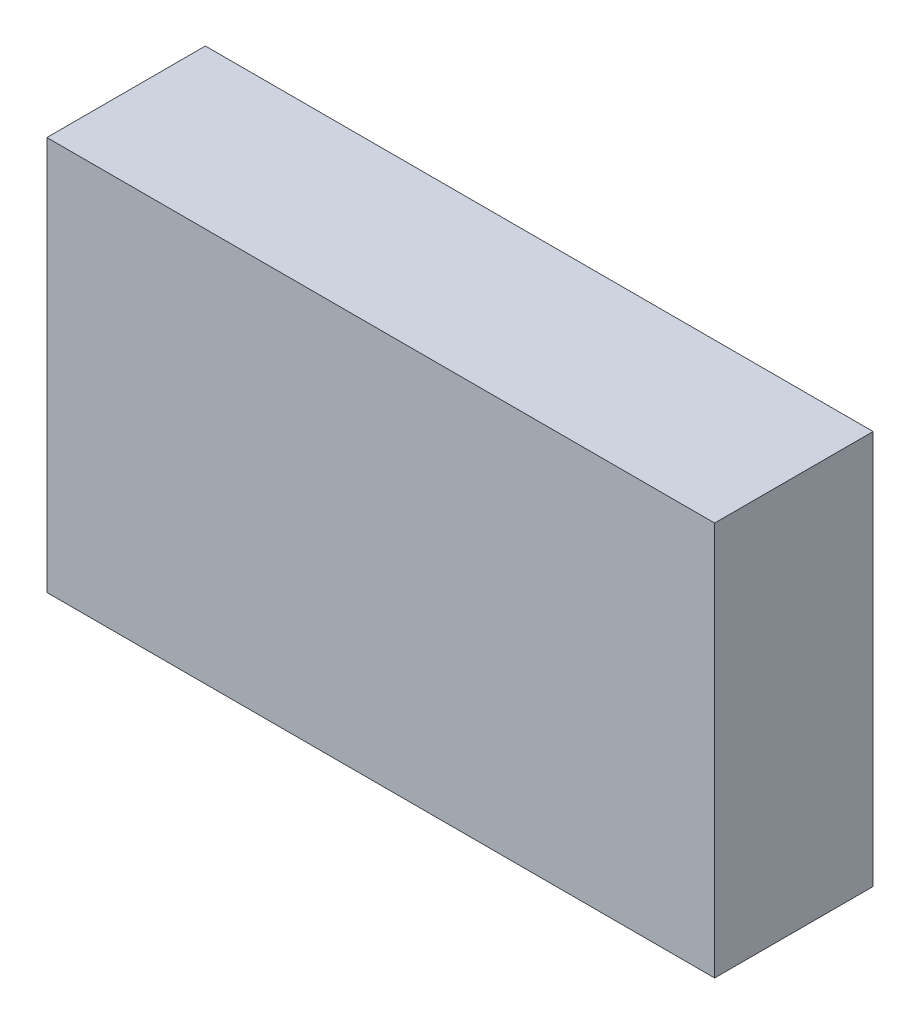
from build123d import *

# Parameters (mm, degrees)
SKETCH1_W           = 290.701999688
SKETCH1_H           = 171.535129294
BOSS_EXTRUDE1_DEPTH = 69


with BuildPart() as part:
    # Sketch1 → Boss-Extrude1 (new body)
    with BuildSketch(Plane.XY):
        with Locations((-34.138467147, -3.178917492)):
            Rectangle(SKETCH1_W, SKETCH1_H)
    extrude(amount=BOSS_EXTRUDE1_DEPTH)


solid = part.part
